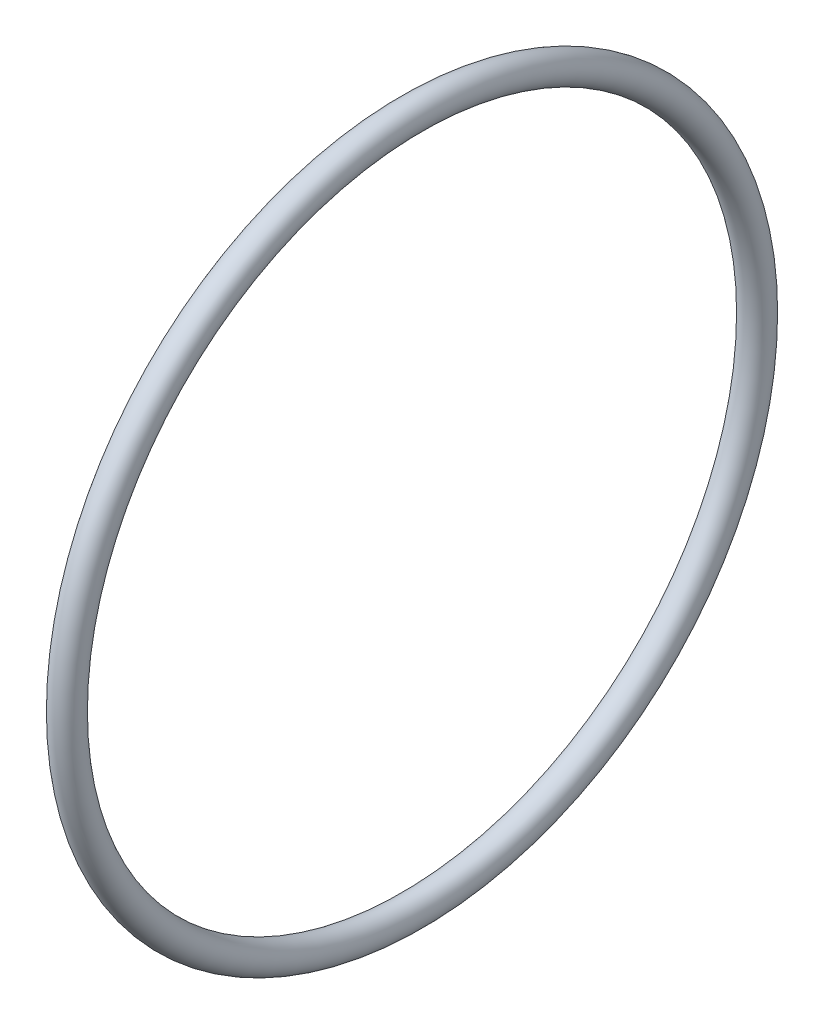
from build123d import *

# Parameters (mm, degrees)
SKETCH4_R = 0.9


with BuildPart() as part:
    # Sketch4 → Revolve1 (revolve)
    with BuildSketch(Plane.XY, mode=Mode.PRIVATE) as revolve1_sk:
        with Locations((0, 21.4)):
            Circle(SKETCH4_R)
    revolve(revolve1_sk.sketch.rotate(Axis((-88.898006971, 0, 0), (1, 0, 0)), 90), axis=Axis((-88.898006971, 0, 0), (1, 0, 0)))


solid = part.part
